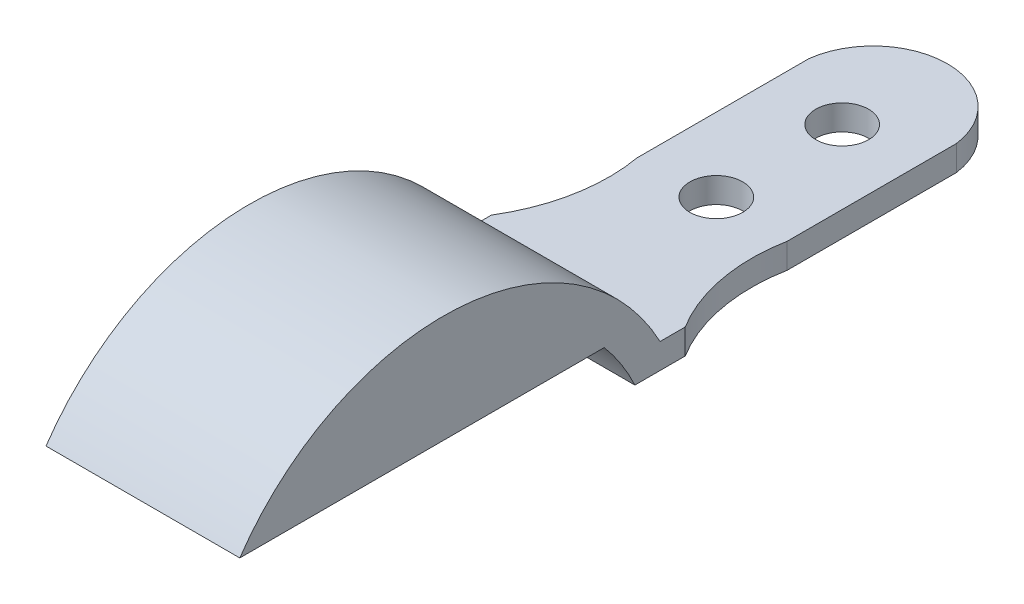
from build123d import *

# Parameters (mm, degrees)
SKETCH1_R                = 2.667
BOSS_EXTRUDE1_DEPTH      = 2.54
BOSS_EXTRUDE7_DEPTH      = 9.779
BOSS_EXTRUDE7_DEPTH_BACK = 9.779
BOSS_EXTRUDE8_DEPTH      = 3.175
BOSS_EXTRUDE9_START      = -3.175
BOSS_EXTRUDE9_DEPTH      = 3.175
CUT_EXTRUDE1_DEPTH       = 66.415448629


with BuildPart() as part:
    # Sketch1 → Boss-Extrude1 (new body)
    with BuildSketch(Plane(origin=(0, 0, 0), x_dir=(1, 0, 0), z_dir=(0, 1, 0))):
        with BuildLine():
            Line((-9.779, -12.918471663), (9.779, -12.918471663))
            ThreePointArc((9.779, -12.918471663), (7.425363666, -6.824700874), (7.431379329, -0.292196741))
            Line((7.431379329, -0.292196741), (7.431379329, 16.796462376))
            ThreePointArc((7.431379329, 16.796462376), (0, 23.317357624), (-7.431379329, 16.796462376))
            Line((-7.431379329, 16.796462376), (-7.431379329, -0.57095897))
            ThreePointArc((-7.431379329, -0.57095897), (-7.47774388, -6.959075495), (-9.779, -12.918471663))
        make_face()
        with Locations(Location((0, 0, 0), (0, 0, 270))):
            Circle(SKETCH1_R, mode=Mode.SUBTRACT)
        with Locations(Location((0, 12.7, 0), (0, 0, 270))):
            Circle(SKETCH1_R, mode=Mode.SUBTRACT)
    extrude(amount=BOSS_EXTRUDE1_DEPTH)

    # Sketch2 → Boss-Extrude7 (add, two sides: drawn at the far end of the back side and taken through both)
    with BuildSketch(Plane(origin=(0, 0, 0), x_dir=(0, 0, -1), z_dir=(1, 0, 0)).offset(-BOSS_EXTRUDE7_DEPTH_BACK)):
        with BuildLine():
            Line((-60.416471663, 0), (-57.114471663, 0))
            ThreePointArc((-57.114471663, 0), (-37.556471663, 12.446), (-17.998471663, 0))
            Line((-17.998471663, 0), (-12.918471663, 0))
            Line((-12.918471663, 0), (-12.918471663, 2.54))
            Line((-12.918471663, 2.54), (-15.458471663, 2.54))
            ThreePointArc((-15.458471663, 2.54), (-38.750541785, 15.661341156), (-60.416471663, 0))
        make_face()
    extrude(amount=BOSS_EXTRUDE7_DEPTH + BOSS_EXTRUDE7_DEPTH_BACK)

    # Sketch8 → Boss-Extrude8 (add)
    with BuildSketch(Plane.ZY.offset(9.779)):
        with BuildLine():
            Line((21.095390289, 4.826), (54.017553037, 4.826))
            ThreePointArc((54.017553037, 4.826), (37.556471663, 12.446), (21.095390289, 4.826))
        make_face()
    extrude(amount=-BOSS_EXTRUDE8_DEPTH)

    # Sketch9 → Boss-Extrude9 (add)
    with BuildSketch(Plane(origin=(9.779, 0, 0), x_dir=(0, 0, -1), z_dir=(1, 0, 0)).offset(BOSS_EXTRUDE9_START)):
        with BuildLine():
            Line((-54.017553037, 4.826), (-21.095390289, 4.826))
            ThreePointArc((-21.095390289, 4.826), (-37.556471663, 12.446), (-54.017553037, 4.826))
        make_face()
    extrude(amount=BOSS_EXTRUDE9_DEPTH)

    # Sketch10 → Cut-Extrude1 (cut, through all)
    with BuildSketch(Plane.ZY.offset(9.779)):
        with BuildLine():
            Line((54.017553037, 4.826), (57.868824209, 4.826))
            ThreePointArc((57.868824209, 4.826), (59.275844237, 2.483314384), (60.416471663, 0))
            Line((60.416471663, 0), (57.114471663, 0))
            ThreePointArc((57.114471663, 0), (55.726945646, 2.516273378), (54.017553037, 4.826))
        make_face()
    extrude(amount=-CUT_EXTRUDE1_DEPTH, mode=Mode.SUBTRACT)


solid = part.part
